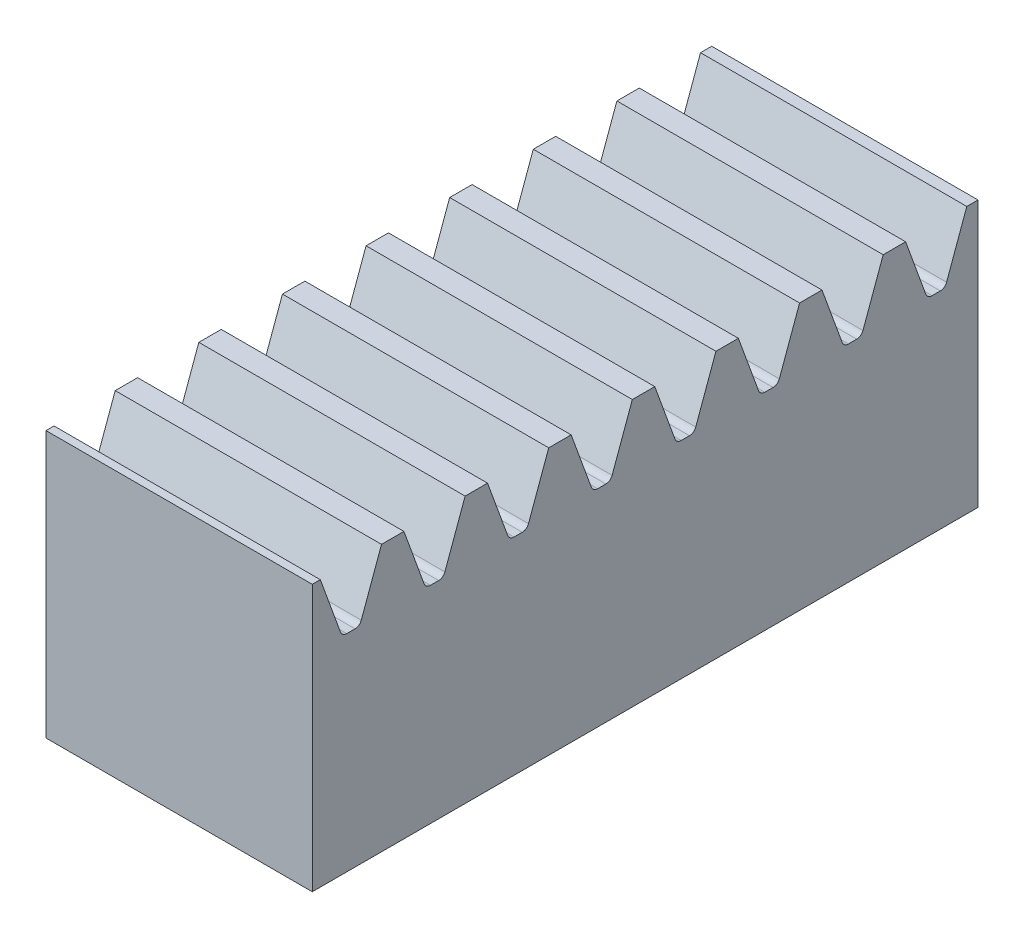
from build123d import *

# Parameters (mm, degrees)
SKETCH_1_W             = 20
SKETCH_1_H             = 20
EXTRUDE_1_DEPTH        = 50
CUT_EXTRUDE_1_DEPTH    = 57.780278266
PATTERN_LINEAR_1_COUNT = 8
PATTERN_LINEAR_1_PITCH = 6.28


with BuildPart() as part:
    # 草图1 → 凸台-拉伸1 (new body)
    with BuildSketch(Plane.XY):
        with Locations((0, -8)):
            Rectangle(SKETCH_1_W, SKETCH_1_H)
    extrude(amount=EXTRUDE_1_DEPTH)

    # 草图2 → 切除-拉伸1 (cut, through all)
    with BuildSketch(Plane.ZY.offset(10)):
        with BuildLine():
            Line((0.842059531, 2), (2.360183044, -2.171010072))
            ThreePointArc((2.360183044, -2.171010072), (2.543241137, -2.409576022), (2.830029355, -2.5))
            Line((2.830029355, -2.5), (3.449970645, -2.5))
            ThreePointArc((3.449970645, -2.5), (3.736758863, -2.409576022), (3.919816956, -2.171010072))
            Line((3.919816956, -2.171010072), (5.437940469, 2))
            Line((5.437940469, 2), (0.842059531, 2))
        make_face()
    cut_extrude_1 = extrude(amount=-CUT_EXTRUDE_1_DEPTH, mode=Mode.SUBTRACT)

    # 阵列(线性)1: 切除-拉伸1 ×8
    with Locations(*[(0, 0, i * PATTERN_LINEAR_1_PITCH) for i in range(1, PATTERN_LINEAR_1_COUNT)]):
        add(cut_extrude_1, mode=Mode.SUBTRACT)


solid = part.part
